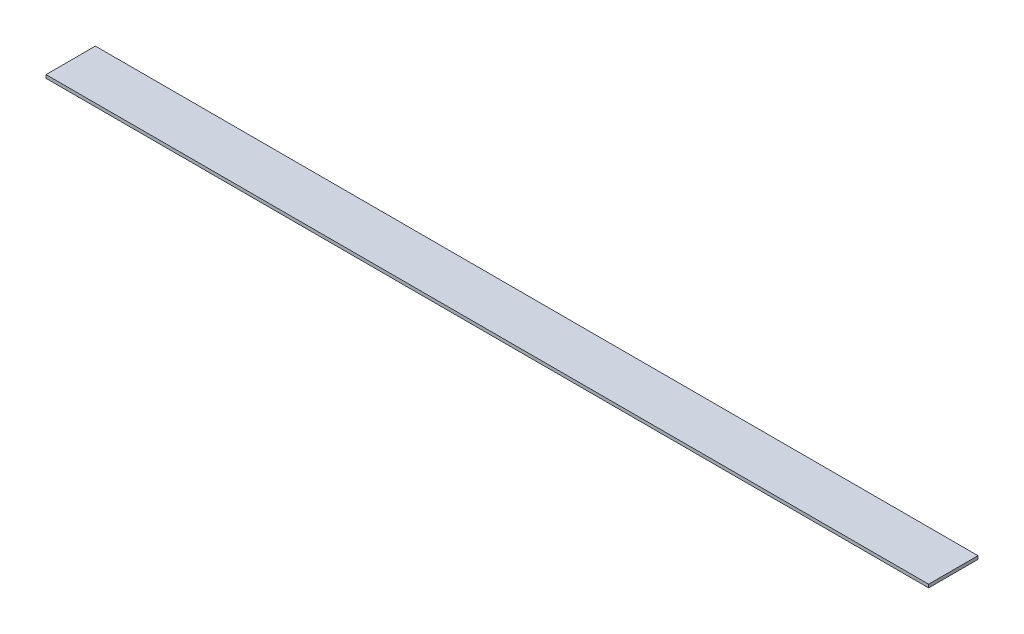
from build123d import *

# Parameters (mm, degrees)
SKETCH1_W           = 227
SKETCH1_H           = 12.7
BOSS_EXTRUDE1_DEPTH = 0.8382


with BuildPart() as part:
    # Sketch1 → Boss-Extrude1 (new body)
    with BuildSketch(Plane(origin=(0, 0, 0), x_dir=(1, 0, 0), z_dir=(0, 1, 0))):
        with Locations((113.5, -6.35)):
            Rectangle(SKETCH1_W, SKETCH1_H)
    extrude(amount=-BOSS_EXTRUDE1_DEPTH)


solid = part.part
